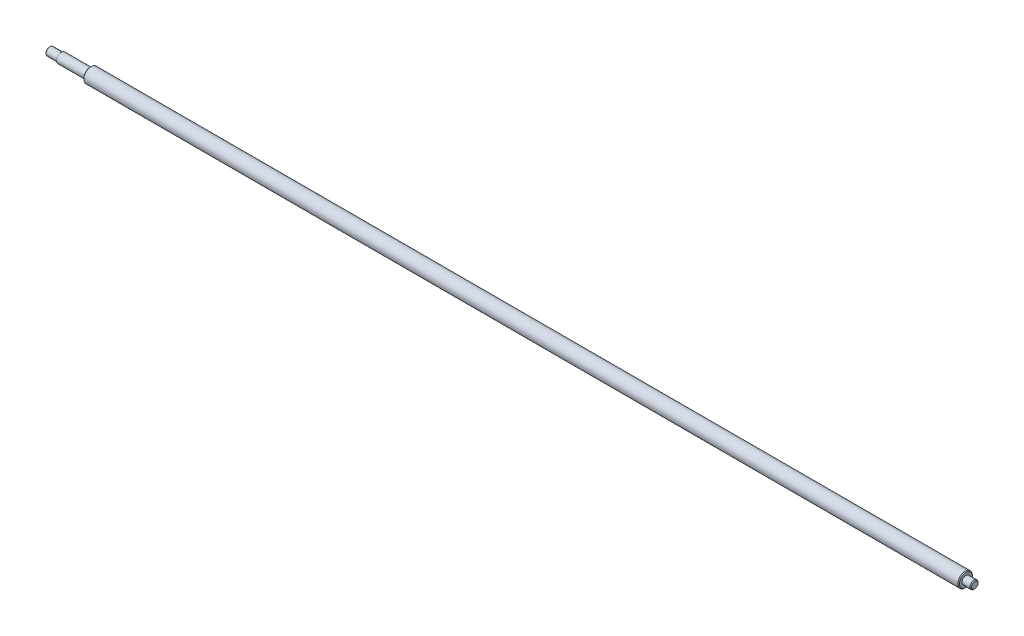
from build123d import *


with BuildPart() as part:
    # Sketch1 → Revolve1 (revolve)
    with BuildSketch(Plane(origin=(0, 0, 0), x_dir=(1, 0, 0), z_dir=(0, 1, 0)), mode=Mode.PRIVATE) as revolve1_sk:
        Polygon((-208.466913465, 0), (-208.466913465, 4), (-207.466913465, 5), (-193.466913465, 5), (-193.466913465, 6), (-157.466913465, 6), (-157.466913465, 8), (-156.466913465, 9), (929.533086535, 9), (930.533086535, 8), (930.533086535, 5), (940.533086535, 5), (941.533086535, 4), (941.533086535, 0), align=None)
    revolve(revolve1_sk.sketch.rotate(Axis((-222.96414574, 0, 0), (1, 0, 0)), 180), axis=Axis((-222.96414574, 0, 0), (1, 0, 0)))


solid = part.part
